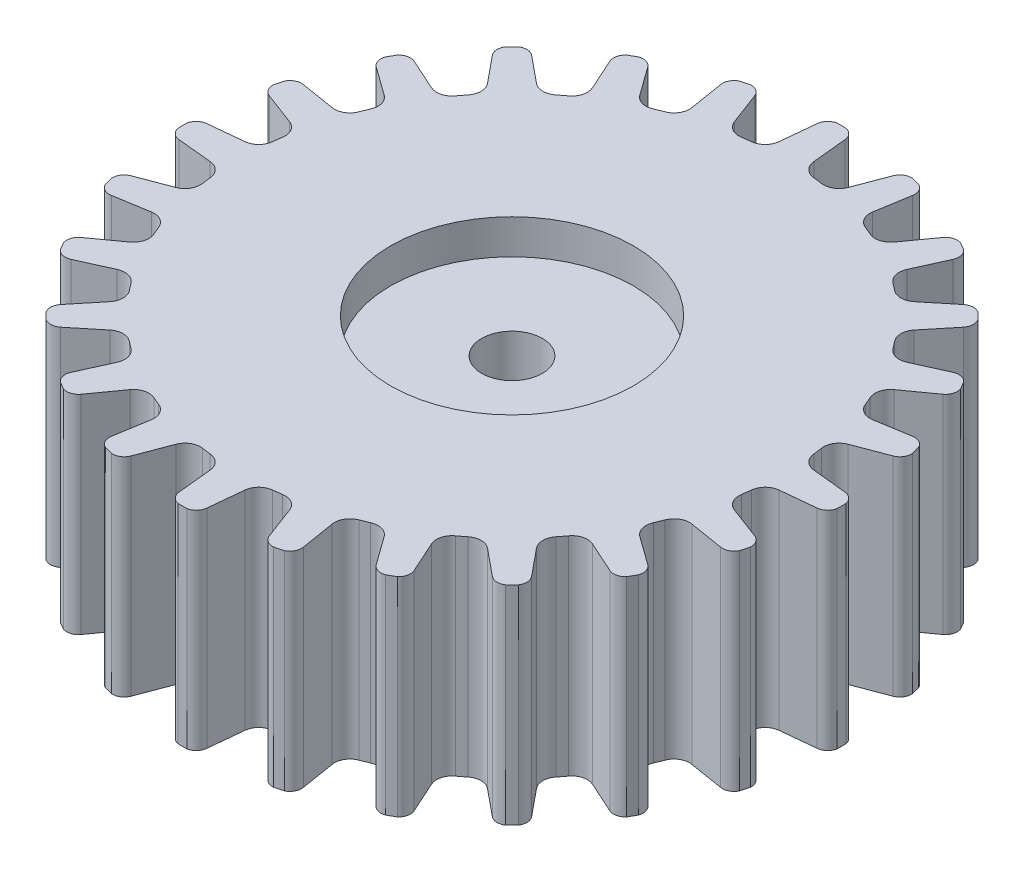
from build123d import *

# Parameters (mm, degrees)
SKETCH1_R           = 9.5
SKETCH1_R_2         = 2.45
BOSS_EXTRUDE1_DEPTH = 6
CUT_EXTRUDE1_START  = -6
SKETCH2_R           = 11.178148921
CUT_EXTRUDE1_DEPTH  = 6
BOSS_EXTRUDE2_START = -3.25
SKETCH3_R           = 2.45
SKETCH3_R_2         = 0.875
BOSS_EXTRUDE2_DEPTH = 3.25
SKETCH4_R           = 3.5
CUT_EXTRUDE2_DEPTH  = 1


with BuildPart() as part:
    # Sketch1 → Boss-Extrude1 (new body)
    with BuildSketch(Plane(origin=(0, 0, 0), x_dir=(1, 0, 0), z_dir=(0, 1, 0))):
        with Locations(Location((0, 0, 0), (0, 0, 270))):
            Circle(SKETCH1_R)
        with Locations(Location((0, 0, 0), (0, 0, 270))):
            Circle(SKETCH1_R_2, mode=Mode.SUBTRACT)
    extrude(amount=BOSS_EXTRUDE1_DEPTH)

    # Sketch2 → Cut-Extrude1 (cut)
    with BuildSketch(Plane(origin=(0, 6, 0), x_dir=(1, 0, 0), z_dir=(0, 1, 0)).offset(CUT_EXTRUDE1_START)):
        Circle(SKETCH2_R)
        with BuildLine():
            Line((0.5, 8.2), (0.4, 9.2))
            ThreePointArc((0.4, 9.2), (0.265875857, 9.437834476), (0, 9.5))
            ThreePointArc((0, 9.5), (-0.265875857, 9.437834476), (-0.4, 9.2))
            Line((-0.4, 9.2), (-0.5, 8.2))
            ThreePointArc((-0.5, 8.2), (-0.628607324, 7.928607324), (-0.9, 7.8))
            ThreePointArc((-0.9, 7.8), (-1.024859212, 7.784578575), (-1.149455308, 7.767158586))
            ThreePointArc((-1.149455308, 7.767158586), (-1.444886527, 7.821142129), (-1.639353257, 8.050001298))
            Line((-1.639353257, 8.050001298), (-1.994764884, 8.99004522))
            ThreePointArc((-1.994764884, 8.99004522), (-2.18587495, 9.1850618), (-2.458780928, 9.17629535))
            ThreePointArc((-2.458780928, 9.17629535), (-2.699507664, 9.047434329), (-2.767505545, 8.782989984))
            Line((-2.767505545, 8.782989984), (-2.605279083, 7.791182253))
            ThreePointArc((-2.605279083, 7.791182253), (-2.659262626, 7.495751034), (-2.888121795, 7.301284304))
            ThreePointArc((-2.888121795, 7.301284304), (-3.004735175, 7.25407241), (-3.120577137, 7.20499815))
            ThreePointArc((-3.120577137, 7.20499815), (-3.41991375, 7.180679022), (-3.666987298, 7.351408311))
            Line((-3.666987298, 7.351408311), (-4.253589838, 8.167433715))
            ThreePointArc((-4.253589838, 8.167433715), (-4.488661992, 8.306342342), (-4.75, 8.227241336))
            ThreePointArc((-4.75, 8.227241336), (-4.949172485, 8.040466485), (-4.946410162, 7.767433715))
            Line((-4.946410162, 7.767433715), (-4.533012702, 6.851408311))
            ThreePointArc((-4.533012702, 6.851408311), (-4.508693574, 6.552071697), (-4.679422863, 6.30499815))
            ThreePointArc((-4.679422863, 6.30499815), (-4.779843401, 6.229213198), (-4.87903679, 6.151828996))
            ThreePointArc((-4.87903679, 6.151828996), (-5.161879503, 6.050864506), (-5.444722215, 6.151828996))
            Line((-5.444722215, 6.151828996), (-6.222539674, 6.788225099))
            ThreePointArc((-6.222539674, 6.788225099), (-6.485554136, 6.861559379), (-6.717514421, 6.717514421))
            ThreePointArc((-6.717514421, 6.717514421), (-6.861559379, 6.485554136), (-6.788225099, 6.222539674))
            Line((-6.788225099, 6.222539674), (-6.151828996, 5.444722215))
            ThreePointArc((-6.151828996, 5.444722215), (-6.050864506, 5.161879503), (-6.151828996, 4.87903679))
            ThreePointArc((-6.151828996, 4.87903679), (-6.229213198, 4.779843401), (-6.30499815, 4.679422863))
            ThreePointArc((-6.30499815, 4.679422863), (-6.552071697, 4.508693574), (-6.851408311, 4.533012702))
            Line((-6.851408311, 4.533012702), (-7.767433715, 4.946410162))
            ThreePointArc((-7.767433715, 4.946410162), (-8.040466485, 4.949172485), (-8.227241336, 4.75))
            ThreePointArc((-8.227241336, 4.75), (-8.306342342, 4.488661992), (-8.167433715, 4.253589838))
            Line((-8.167433715, 4.253589838), (-7.351408311, 3.666987298))
            ThreePointArc((-7.351408311, 3.666987298), (-7.180679022, 3.41991375), (-7.20499815, 3.120577137))
            ThreePointArc((-7.20499815, 3.120577137), (-7.25407241, 3.004735175), (-7.301284304, 2.888121795))
            ThreePointArc((-7.301284304, 2.888121795), (-7.495751034, 2.659262626), (-7.791182253, 2.605279083))
            Line((-7.791182253, 2.605279083), (-8.782989984, 2.767505545))
            ThreePointArc((-8.782989984, 2.767505545), (-9.047434329, 2.699507664), (-9.17629535, 2.458780928))
            ThreePointArc((-9.17629535, 2.458780928), (-9.1850618, 2.18587495), (-8.99004522, 1.994764884))
            Line((-8.99004522, 1.994764884), (-8.050001298, 1.639353257))
            ThreePointArc((-8.050001298, 1.639353257), (-7.821142129, 1.444886527), (-7.767158586, 1.149455308))
            ThreePointArc((-7.767158586, 1.149455308), (-7.784578575, 1.024859212), (-7.8, 0.9))
            ThreePointArc((-7.8, 0.9), (-7.928607324, 0.628607324), (-8.2, 0.5))
            Line((-8.2, 0.5), (-9.2, 0.4))
            ThreePointArc((-9.2, 0.4), (-9.437834476, 0.265875857), (-9.5, 0))
            ThreePointArc((-9.5, 0), (-9.437834476, -0.265875857), (-9.2, -0.4))
            Line((-9.2, -0.4), (-8.2, -0.5))
            ThreePointArc((-8.2, -0.5), (-7.928607324, -0.628607324), (-7.8, -0.9))
            ThreePointArc((-7.8, -0.9), (-7.784578575, -1.024859212), (-7.767158586, -1.149455308))
            ThreePointArc((-7.767158586, -1.149455308), (-7.821142129, -1.444886527), (-8.050001298, -1.639353257))
            Line((-8.050001298, -1.639353257), (-8.99004522, -1.994764884))
            ThreePointArc((-8.99004522, -1.994764884), (-9.1850618, -2.18587495), (-9.17629535, -2.458780928))
            ThreePointArc((-9.17629535, -2.458780928), (-9.047434329, -2.699507664), (-8.782989984, -2.767505545))
            Line((-8.782989984, -2.767505545), (-7.791182253, -2.605279083))
            ThreePointArc((-7.791182253, -2.605279083), (-7.495751034, -2.659262626), (-7.301284304, -2.888121795))
            ThreePointArc((-7.301284304, -2.888121795), (-7.25407241, -3.004735175), (-7.20499815, -3.120577137))
            ThreePointArc((-7.20499815, -3.120577137), (-7.180679022, -3.41991375), (-7.351408311, -3.666987298))
            Line((-7.351408311, -3.666987298), (-8.167433715, -4.253589838))
            ThreePointArc((-8.167433715, -4.253589838), (-8.306342342, -4.488661992), (-8.227241336, -4.75))
            ThreePointArc((-8.227241336, -4.75), (-8.040466485, -4.949172485), (-7.767433715, -4.946410162))
            Line((-7.767433715, -4.946410162), (-6.851408311, -4.533012702))
            ThreePointArc((-6.851408311, -4.533012702), (-6.552071697, -4.508693574), (-6.30499815, -4.679422863))
            ThreePointArc((-6.30499815, -4.679422863), (-6.229213198, -4.779843401), (-6.151828996, -4.87903679))
            ThreePointArc((-6.151828996, -4.87903679), (-6.050864506, -5.161879503), (-6.151828996, -5.444722215))
            Line((-6.151828996, -5.444722215), (-6.788225099, -6.222539674))
            ThreePointArc((-6.788225099, -6.222539674), (-6.861559379, -6.485554136), (-6.717514421, -6.717514421))
            ThreePointArc((-6.717514421, -6.717514421), (-6.485554136, -6.861559379), (-6.222539674, -6.788225099))
            Line((-6.222539674, -6.788225099), (-5.444722215, -6.151828996))
            ThreePointArc((-5.444722215, -6.151828996), (-5.161879503, -6.050864506), (-4.87903679, -6.151828996))
            ThreePointArc((-4.87903679, -6.151828996), (-4.779843401, -6.229213198), (-4.679422863, -6.30499815))
            ThreePointArc((-4.679422863, -6.30499815), (-4.508693574, -6.552071697), (-4.533012702, -6.851408311))
            Line((-4.533012702, -6.851408311), (-4.946410162, -7.767433715))
            ThreePointArc((-4.946410162, -7.767433715), (-4.949172485, -8.040466485), (-4.75, -8.227241336))
            ThreePointArc((-4.75, -8.227241336), (-4.488661992, -8.306342342), (-4.253589838, -8.167433715))
            Line((-4.253589838, -8.167433715), (-3.666987298, -7.351408311))
            ThreePointArc((-3.666987298, -7.351408311), (-3.41991375, -7.180679022), (-3.120577137, -7.20499815))
            ThreePointArc((-3.120577137, -7.20499815), (-3.004735175, -7.25407241), (-2.888121795, -7.301284304))
            ThreePointArc((-2.888121795, -7.301284304), (-2.659262626, -7.495751034), (-2.605279083, -7.791182253))
            Line((-2.605279083, -7.791182253), (-2.767505545, -8.782989984))
            ThreePointArc((-2.767505545, -8.782989984), (-2.699507664, -9.047434329), (-2.458780928, -9.17629535))
            ThreePointArc((-2.458780928, -9.17629535), (-2.18587495, -9.1850618), (-1.994764884, -8.99004522))
            Line((-1.994764884, -8.99004522), (-1.639353257, -8.050001298))
            ThreePointArc((-1.639353257, -8.050001298), (-1.444886527, -7.821142129), (-1.149455308, -7.767158586))
            ThreePointArc((-1.149455308, -7.767158586), (-1.024859212, -7.784578575), (-0.9, -7.8))
            ThreePointArc((-0.9, -7.8), (-0.628607324, -7.928607324), (-0.5, -8.2))
            Line((-0.5, -8.2), (-0.4, -9.2))
            ThreePointArc((-0.4, -9.2), (-0.265875857, -9.437834476), (0, -9.5))
            ThreePointArc((0, -9.5), (0.265875857, -9.437834476), (0.4, -9.2))
            Line((0.4, -9.2), (0.5, -8.2))
            ThreePointArc((0.5, -8.2), (0.628607324, -7.928607324), (0.9, -7.8))
            ThreePointArc((0.9, -7.8), (1.024859212, -7.784578575), (1.149455308, -7.767158586))
            ThreePointArc((1.149455308, -7.767158586), (1.444886527, -7.821142129), (1.639353257, -8.050001298))
            Line((1.639353257, -8.050001298), (1.994764884, -8.99004522))
            ThreePointArc((1.994764884, -8.99004522), (2.18587495, -9.1850618), (2.458780928, -9.17629535))
            ThreePointArc((2.458780928, -9.17629535), (2.699507664, -9.047434329), (2.767505545, -8.782989984))
            Line((2.767505545, -8.782989984), (2.605279083, -7.791182253))
            ThreePointArc((2.605279083, -7.791182253), (2.659262626, -7.495751034), (2.888121795, -7.301284304))
            ThreePointArc((2.888121795, -7.301284304), (3.004735175, -7.25407241), (3.120577137, -7.20499815))
            ThreePointArc((3.120577137, -7.20499815), (3.41991375, -7.180679022), (3.666987298, -7.351408311))
            Line((3.666987298, -7.351408311), (4.253589838, -8.167433715))
            ThreePointArc((4.253589838, -8.167433715), (4.488661992, -8.306342342), (4.75, -8.227241336))
            ThreePointArc((4.75, -8.227241336), (4.949172485, -8.040466485), (4.946410162, -7.767433715))
            Line((4.946410162, -7.767433715), (4.533012702, -6.851408311))
            ThreePointArc((4.533012702, -6.851408311), (4.508693574, -6.552071697), (4.679422863, -6.30499815))
            ThreePointArc((4.679422863, -6.30499815), (4.779843401, -6.229213198), (4.87903679, -6.151828996))
            ThreePointArc((4.87903679, -6.151828996), (5.161879503, -6.050864506), (5.444722215, -6.151828996))
            Line((5.444722215, -6.151828996), (6.222539674, -6.788225099))
            ThreePointArc((6.222539674, -6.788225099), (6.485554136, -6.861559379), (6.717514421, -6.717514421))
            ThreePointArc((6.717514421, -6.717514421), (6.861559379, -6.485554136), (6.788225099, -6.222539674))
            Line((6.788225099, -6.222539674), (6.151828996, -5.444722215))
            ThreePointArc((6.151828996, -5.444722215), (6.050864506, -5.161879503), (6.151828996, -4.87903679))
            ThreePointArc((6.151828996, -4.87903679), (6.229213198, -4.779843401), (6.30499815, -4.679422863))
            ThreePointArc((6.30499815, -4.679422863), (6.552071697, -4.508693574), (6.851408311, -4.533012702))
            Line((6.851408311, -4.533012702), (7.767433715, -4.946410162))
            ThreePointArc((7.767433715, -4.946410162), (8.040466485, -4.949172485), (8.227241336, -4.75))
            ThreePointArc((8.227241336, -4.75), (8.306342342, -4.488661992), (8.167433715, -4.253589838))
            Line((8.167433715, -4.253589838), (7.351408311, -3.666987298))
            ThreePointArc((7.351408311, -3.666987298), (7.180679022, -3.41991375), (7.20499815, -3.120577137))
            ThreePointArc((7.20499815, -3.120577137), (7.25407241, -3.004735175), (7.301284304, -2.888121795))
            ThreePointArc((7.301284304, -2.888121795), (7.495751034, -2.659262626), (7.791182253, -2.605279083))
            Line((7.791182253, -2.605279083), (8.782989984, -2.767505545))
            ThreePointArc((8.782989984, -2.767505545), (9.047434329, -2.699507664), (9.17629535, -2.458780928))
            ThreePointArc((9.17629535, -2.458780928), (9.1850618, -2.18587495), (8.99004522, -1.994764884))
            Line((8.99004522, -1.994764884), (8.050001298, -1.639353257))
            ThreePointArc((8.050001298, -1.639353257), (7.821142129, -1.444886527), (7.767158586, -1.149455308))
            ThreePointArc((7.767158586, -1.149455308), (7.784578575, -1.024859212), (7.8, -0.9))
            ThreePointArc((7.8, -0.9), (7.928607324, -0.628607324), (8.2, -0.5))
            Line((8.2, -0.5), (9.2, -0.4))
            ThreePointArc((9.2, -0.4), (9.437834476, -0.265875857), (9.5, 0))
            ThreePointArc((9.5, 0), (9.437834476, 0.265875857), (9.2, 0.4))
            Line((9.2, 0.4), (8.2, 0.5))
            ThreePointArc((8.2, 0.5), (7.928607324, 0.628607324), (7.8, 0.9))
            ThreePointArc((7.8, 0.9), (7.784578575, 1.024859212), (7.767158586, 1.149455308))
            ThreePointArc((7.767158586, 1.149455308), (7.821142129, 1.444886527), (8.050001298, 1.639353257))
            Line((8.050001298, 1.639353257), (8.99004522, 1.994764884))
            ThreePointArc((8.99004522, 1.994764884), (9.1850618, 2.18587495), (9.17629535, 2.458780928))
            ThreePointArc((9.17629535, 2.458780928), (9.047434329, 2.699507664), (8.782989984, 2.767505545))
            Line((8.782989984, 2.767505545), (7.791182253, 2.605279083))
            ThreePointArc((7.791182253, 2.605279083), (7.495751034, 2.659262626), (7.301284304, 2.888121795))
            ThreePointArc((7.301284304, 2.888121795), (7.25407241, 3.004735175), (7.20499815, 3.120577137))
            ThreePointArc((7.20499815, 3.120577137), (7.180679022, 3.41991375), (7.351408311, 3.666987298))
            Line((7.351408311, 3.666987298), (8.167433715, 4.253589838))
            ThreePointArc((8.167433715, 4.253589838), (8.306342342, 4.488661992), (8.227241336, 4.75))
            ThreePointArc((8.227241336, 4.75), (8.040466485, 4.949172485), (7.767433715, 4.946410162))
            Line((7.767433715, 4.946410162), (6.851408311, 4.533012702))
            ThreePointArc((6.851408311, 4.533012702), (6.552071697, 4.508693574), (6.30499815, 4.679422863))
            ThreePointArc((6.30499815, 4.679422863), (6.229213198, 4.779843401), (6.151828996, 4.87903679))
            ThreePointArc((6.151828996, 4.87903679), (6.050864506, 5.161879503), (6.151828996, 5.444722215))
            Line((6.151828996, 5.444722215), (6.788225099, 6.222539674))
            ThreePointArc((6.788225099, 6.222539674), (6.861559379, 6.485554136), (6.717514421, 6.717514421))
            ThreePointArc((6.717514421, 6.717514421), (6.485554136, 6.861559379), (6.222539674, 6.788225099))
            Line((6.222539674, 6.788225099), (5.444722215, 6.151828996))
            ThreePointArc((5.444722215, 6.151828996), (5.161879503, 6.050864506), (4.87903679, 6.151828996))
            ThreePointArc((4.87903679, 6.151828996), (4.779843401, 6.229213198), (4.679422863, 6.30499815))
            ThreePointArc((4.679422863, 6.30499815), (4.508693574, 6.552071697), (4.533012702, 6.851408311))
            Line((4.533012702, 6.851408311), (4.946410162, 7.767433715))
            ThreePointArc((4.946410162, 7.767433715), (4.949172485, 8.040466485), (4.75, 8.227241336))
            ThreePointArc((4.75, 8.227241336), (4.488661992, 8.306342342), (4.253589838, 8.167433715))
            Line((4.253589838, 8.167433715), (3.666987298, 7.351408311))
            ThreePointArc((3.666987298, 7.351408311), (3.41991375, 7.180679022), (3.120577137, 7.20499815))
            ThreePointArc((3.120577137, 7.20499815), (3.004735175, 7.25407241), (2.888121795, 7.301284304))
            ThreePointArc((2.888121795, 7.301284304), (2.659262626, 7.495751034), (2.605279083, 7.791182253))
            Line((2.605279083, 7.791182253), (2.767505545, 8.782989984))
            ThreePointArc((2.767505545, 8.782989984), (2.699507664, 9.047434329), (2.458780928, 9.17629535))
            ThreePointArc((2.458780928, 9.17629535), (2.18587495, 9.1850618), (1.994764884, 8.99004522))
            Line((1.994764884, 8.99004522), (1.639353257, 8.050001298))
            ThreePointArc((1.639353257, 8.050001298), (1.444886527, 7.821142129), (1.149455308, 7.767158586))
            ThreePointArc((1.149455308, 7.767158586), (1.024859212, 7.784578575), (0.9, 7.8))
            ThreePointArc((0.9, 7.8), (0.628607324, 7.928607324), (0.5, 8.2))
        make_face(mode=Mode.SUBTRACT)
    extrude(amount=CUT_EXTRUDE1_DEPTH, mode=Mode.SUBTRACT)

    # Sketch3 → Boss-Extrude2 (add)
    with BuildSketch(Plane(origin=(0, 6, 0), x_dir=(1, 0, 0), z_dir=(0, 1, 0)).offset(BOSS_EXTRUDE2_START)):
        with Locations(Location((0, 0, 0), (0, 0, 270))):
            Circle(SKETCH3_R)
        with Locations(Location((0, 0, 0), (0, 0, 270))):
            Circle(SKETCH3_R_2, mode=Mode.SUBTRACT)
    extrude(amount=BOSS_EXTRUDE2_DEPTH)

    # Sketch4 → Cut-Extrude2 (cut)
    with BuildSketch(Plane(origin=(0, 6, 0), x_dir=(1, 0, 0), z_dir=(0, 1, 0))):
        with Locations(Location((0, 0, 0), (0, 0, 270))):
            Circle(SKETCH4_R)
    extrude(amount=-CUT_EXTRUDE2_DEPTH, mode=Mode.SUBTRACT)


solid = part.part
